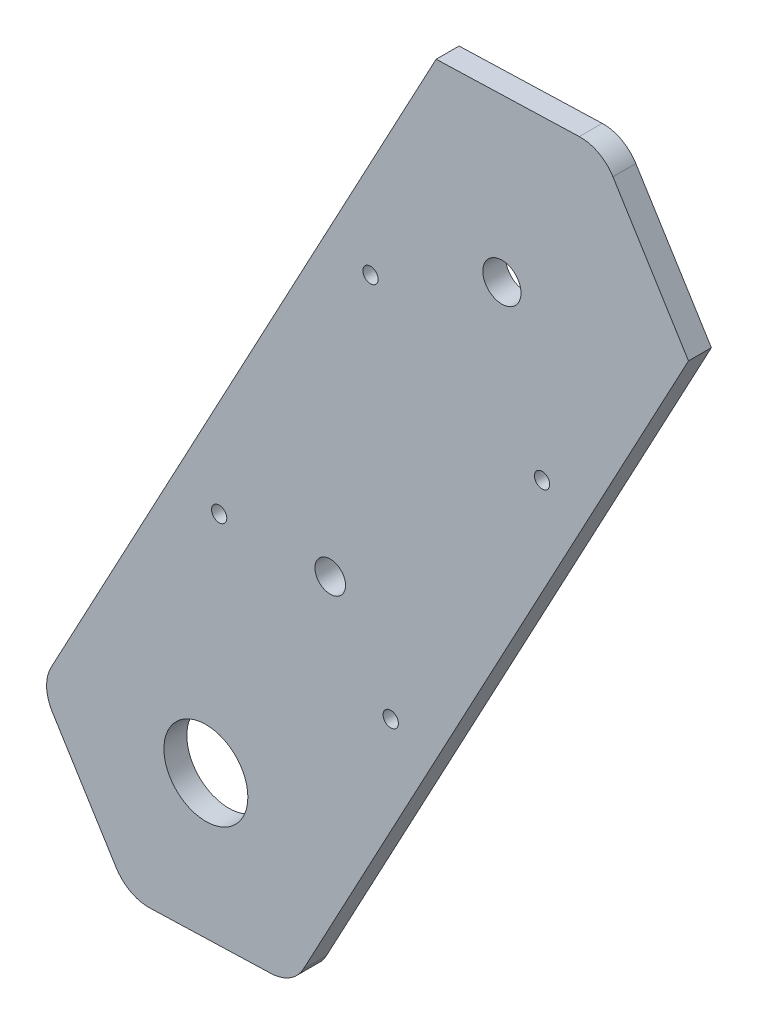
from build123d import *

# Parameters (mm, degrees)
SKETCH1_R           = 5
SKETCH1_R_2         = 2
SKETCH1_R_3         = 4
SKETCH1_R_4         = 11
BOSS_EXTRUDE1_DEPTH = 6


with BuildPart() as part:
    # Sketch1 → Boss-Extrude1 (new body)
    with BuildSketch(Plane.XY):
        with BuildLine():
            Line((-91.133667709, 81.856650449), (-59.395664216, 82.872754588))
            ThreePointArc((-59.395664216, 82.872754588), (-54.441095215, 84.371809376), (-50.89983999, 88.147313406))
            Line((-50.89983999, 88.147313406), (49.994476852, 276.580618392))
            Line((49.994476852, 276.580618392), (30.200235156, 308.463550017))
            ThreePointArc((30.200235156, 308.463550017), (26.424731127, 312.004805242), (21.384421113, 313.183870213))
            Line((21.384421113, 313.183870213), (-16.12412847, 311.983019868))
            Line((-16.12412847, 311.983019868), (-117.018445312, 123.549714881))
            ThreePointArc((-117.018445312, 123.549714881), (-118.197510284, 118.509404868), (-116.698455495, 113.554835867))
            Line((-116.698455495, 113.554835867), (-99.949481752, 86.576970646))
            ThreePointArc((-99.949481752, 86.576970646), (-96.173977723, 83.035715421), (-91.133667709, 81.856650449))
        make_face()
        with Locations((1.104829999, 270.012836125)):
            Circle(SKETCH1_R, mode=Mode.SUBTRACT)
        with Locations((-33.33250289, 254.422130449)):
            Circle(SKETCH1_R_2, mode=Mode.SUBTRACT)
        with Locations((11.628148729, 230.348497445)):
            Circle(SKETCH1_R_2, mode=Mode.SUBTRACT)
        with Locations((-28.022540924, 156.295659484)):
            Circle(SKETCH1_R_2, mode=Mode.SUBTRACT)
        with Locations((-43.879665152, 180.702169371)):
            Circle(SKETCH1_R_3, mode=Mode.SUBTRACT)
        with Locations((-72.983192543, 180.369292488)):
            Circle(SKETCH1_R_2, mode=Mode.SUBTRACT)
        with Locations((-76.464627777, 119.845498823)):
            Circle(SKETCH1_R_4, mode=Mode.SUBTRACT)
    extrude(amount=BOSS_EXTRUDE1_DEPTH)


solid = part.part
